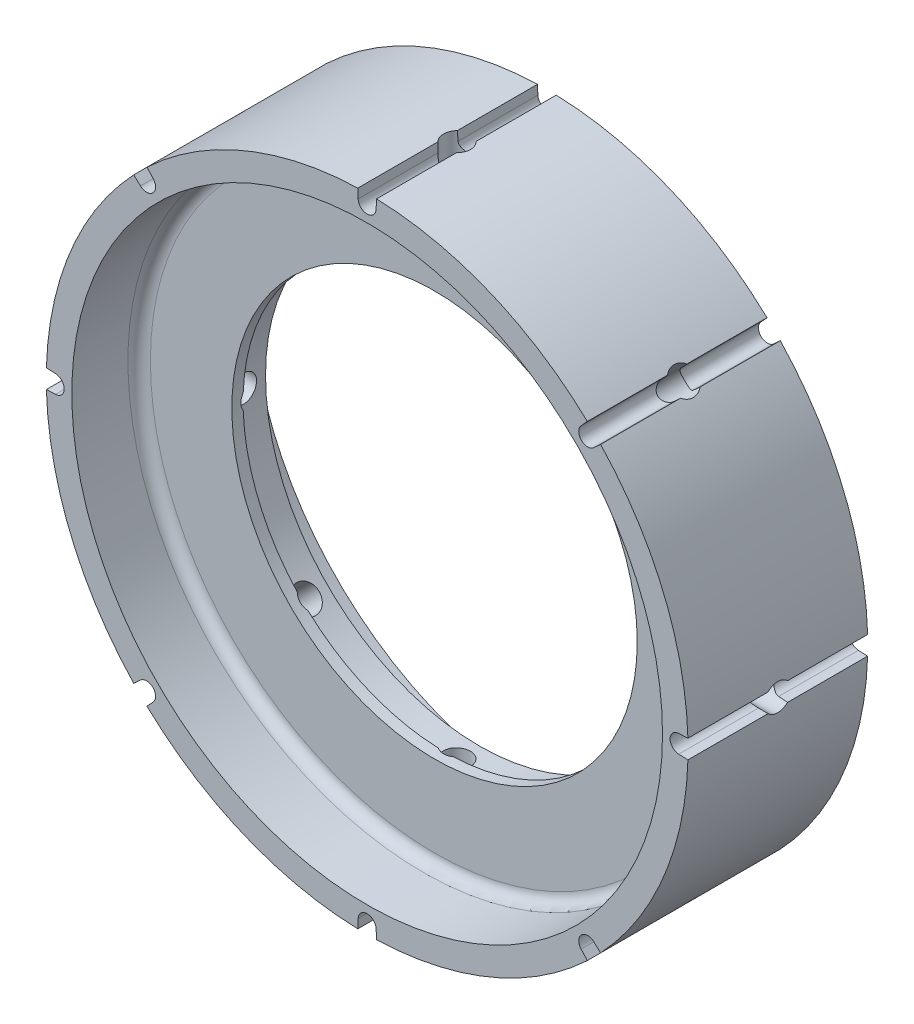
from build123d import *

# Parameters (mm, degrees)
SKETCH1_R           = 14.2875
SKETCH1_R_2         = 13.15
BOSS_EXTRUDE1_DEPTH = 3
BOSS_EXTRUDE2_START = 2
SKETCH2_R           = 14.2875
SKETCH2_R_2         = 9.025
BOSS_EXTRUDE2_DEPTH = 2
BOSS_EXTRUDE3_START = 3
SKETCH3_R           = 14.2875
SKETCH3_R_2         = 13.15
BOSS_EXTRUDE3_DEPTH = 3
FILLET1_R           = 0.5
SKETCH4_R           = 9.525
CUT_EXTRUDE2_DEPTH  = 1.5
SKETCH5_R           = 0.4
CUT_EXTRUDE4_DEPTH  = 22.731666123
CUT_EXTRUDE5_DEPTH  = 10
CIRPATTERN1_COUNT   = 8


with BuildPart() as part:
    # Sketch1 → Boss-Extrude1 (new body)
    with BuildSketch(Plane.XY):
        Circle(SKETCH1_R)
        Circle(SKETCH1_R_2, mode=Mode.SUBTRACT)
    extrude(amount=-BOSS_EXTRUDE1_DEPTH)

    # Sketch2 → Boss-Extrude2 (add)
    with BuildSketch(Plane.XY.offset(BOSS_EXTRUDE2_START)):
        Circle(SKETCH2_R)
        Circle(SKETCH2_R_2, mode=Mode.SUBTRACT)
    extrude(amount=-BOSS_EXTRUDE2_DEPTH)

    # Sketch3 → Boss-Extrude3 (add)
    with BuildSketch(Plane.XY.offset(2).offset(BOSS_EXTRUDE3_START)):
        Circle(SKETCH3_R)
        Circle(SKETCH3_R_2, mode=Mode.SUBTRACT)
    extrude(amount=-BOSS_EXTRUDE3_DEPTH)

    # Fillet1
    fillet1_edges = [part.edges().sort_by_distance(p)[0] for p in [
        (-13.15, 0, 0),
        (-13.15, 0, 2),
    ]]
    fillet(fillet1_edges, radius=FILLET1_R)

    # Sketch4 → Cut-Extrude2 (cut)
    with BuildSketch(Plane(origin=(0, 0, 0), x_dir=(-1, 0, 0), z_dir=(0, 0, -1))):
        Circle(SKETCH4_R)
    extrude(amount=-CUT_EXTRUDE2_DEPTH, mode=Mode.SUBTRACT)

    # Sketch5 → Cut-Extrude4 (cut, through all)
    with BuildSketch(Plane(origin=(0, 0, -3), x_dir=(-1, 0, 0), z_dir=(0, 0, -1))):
        with Locations((-13.8875, 0)):
            Circle(SKETCH5_R)
        with BuildLine():
            ThreePointArc((-14.2875, 1.1e-08), (-14.164417622, 0.288646204), (-13.870916856, 0.399656101))
            Line((-13.870916856, 0.399656101), (-14.281422414, 0.416689427))
            ThreePointArc((-14.281422414, 0.416689427), (-14.285980523, 0.208366879), (-14.2875, 1.1e-08))
        make_face()
        with BuildLine():
            ThreePointArc((-13.870916856, -0.399656101), (-14.164417629, -0.288646196), (-14.2875, 1.1e-08))
            ThreePointArc((-14.2875, 1.1e-08), (-14.285980523, -0.208366868), (-14.281422414, -0.416689427))
            Line((-14.281422414, -0.416689427), (-13.870916856, -0.399656101))
        make_face()
    cut_extrude4 = extrude(amount=-CUT_EXTRUDE4_DEPTH, mode=Mode.SUBTRACT)

    # Sketch6 → Cut-Extrude5 (cut)
    with BuildSketch(Plane(origin=(14.281422414, 0, 0), x_dir=(0, 0, -1), z_dir=(1, 0, 0))):
        with BuildLine():
            ThreePointArc((-0.568294173, 0.416689427), (-1, 0.6), (-1.431705827, 0.416689427))
            Line((-1.431705827, 0.416689427), (-0.568294173, 0.416689427))
        make_face()
        with BuildLine():
            Line((-0.568294173, 0.416689427), (-1.431705827, 0.416689427))
            ThreePointArc((-1.431705827, 0.416689427), (-1.22469591, -0.5563378), (-0.4, 0))
            ThreePointArc((-0.4, 0), (-0.4436622, 0.22469591), (-0.568294173, 0.416689427))
        make_face()
    cut_extrude5 = extrude(amount=-CUT_EXTRUDE5_DEPTH, mode=Mode.SUBTRACT)

    # CirPattern1: Cut-Extrude4, Cut-Extrude5 ×8 about axis
    cirpattern1_axis = Axis((0, 0, 0), (0, 0, 1))
    add([cut_extrude4.rotate(cirpattern1_axis, i * 360 / CIRPATTERN1_COUNT) for i in range(1, CIRPATTERN1_COUNT)], mode=Mode.SUBTRACT)
    add([cut_extrude5.rotate(cirpattern1_axis, i * 360 / CIRPATTERN1_COUNT) for i in range(1, CIRPATTERN1_COUNT)], mode=Mode.SUBTRACT)


solid = part.part
